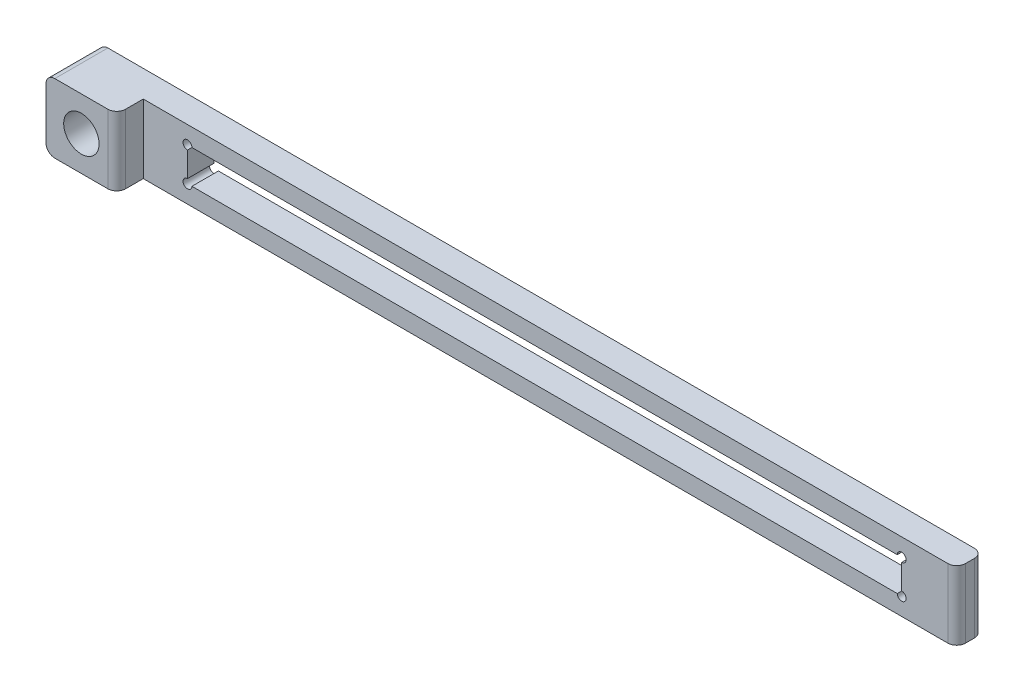
from build123d import *

# Parameters (mm, degrees)
SKIZZE1_W                            = 100
SKIZZE1_H                            = 7.8
SKIZZE1_W_2                          = 80.78
SKIZZE1_H_2                          = 3.8
AUFSATZ_LINEAR_AUSTRAGEN1_DEPTH      = 1.5
SKIZZE3_W                            = 8
SKIZZE3_H                            = 7.8
AUFSATZ_LINEAR_AUSTRAGEN2_DEPTH      = 3
SCHNITT_LINEAR_AUSTRAGEN4_DEPTH      = 51.509504056
SCHNITT_LINEAR_AUSTRAGEN4_DEPTH_BACK = 51.509504056
SKIZZE5_R                            = 2
VERRUNDUNG1_R                        = 1
VERRUNDUNG2_R                        = 1
VERRUNDUNG3_R                        = 1
VERRUNDUNG4_R                        = 1
VERRUNDUNG5_R                        = 1
LOCHUNGSSKIZZE_R                     = 0.5
RAHMENLOCHUNGEN_DEPTH                = 51.241516697


with BuildPart() as part:
    # Skizze1 → Aufsatz-Linear austragen1 (new, symmetric)
    with BuildSketch(Plane.XY):
        Rectangle(SKIZZE1_W, SKIZZE1_H)
        with Locations((3.39, 0)):
            Rectangle(SKIZZE1_W_2, SKIZZE1_H_2, mode=Mode.SUBTRACT)
    extrude(amount=AUFSATZ_LINEAR_AUSTRAGEN1_DEPTH, both=True)

    # Skizze3 → Aufsatz-Linear austragen2 (add)
    with BuildSketch(Plane.XY.offset(1.5)):
        with Locations((-46, 0)):
            Rectangle(SKIZZE3_W, SKIZZE3_H)
    extrude(amount=AUFSATZ_LINEAR_AUSTRAGEN2_DEPTH)

    # Skizze5 → Schnitt-Linear austragen4 (cut, two sides: drawn at the far end of the back side and taken through both)
    with BuildSketch(Plane.XY.offset(4.5).offset(-SCHNITT_LINEAR_AUSTRAGEN4_DEPTH_BACK)):
        with Locations((-46, 0)):
            Circle(SKIZZE5_R)
    extrude(amount=SCHNITT_LINEAR_AUSTRAGEN4_DEPTH + SCHNITT_LINEAR_AUSTRAGEN4_DEPTH_BACK, mode=Mode.SUBTRACT)

    # Verrundung1
    verrundung1_edges = [part.edges().sort_by_distance(p)[0] for p in [
        (-50, 3.9, 1.5),
    ]]
    fillet(verrundung1_edges, radius=VERRUNDUNG1_R)

    # Verrundung2
    verrundung2_edges = [part.edges().sort_by_distance(p)[0] for p in [
        (-50, -3.9, 1.5),
    ]]
    fillet(verrundung2_edges, radius=VERRUNDUNG2_R)

    # Verrundung3
    verrundung3_edges = [part.edges().sort_by_distance(p)[0] for p in [
        (-42, 0, 4.5),
    ]]
    fillet(verrundung3_edges, radius=VERRUNDUNG3_R)

    # Verrundung4
    verrundung4_edges = [part.edges().sort_by_distance(p)[0] for p in [
        (50, 0, -1.5),
    ]]
    fillet(verrundung4_edges, radius=VERRUNDUNG4_R)

    # Verrundung5
    verrundung5_edges = [part.edges().sort_by_distance(p)[0] for p in [
        (50, 0, 1.5),
    ]]
    fillet(verrundung5_edges, radius=VERRUNDUNG5_R)

    # Lochungsskizze → RahmenLochungen (cut, through all)
    with BuildSketch(Plane.XY.offset(1.5)):
        with Locations((-37, 1.9)):
            Circle(LOCHUNGSSKIZZE_R)
        with Locations((-37, -1.9)):
            Circle(LOCHUNGSSKIZZE_R)
        with Locations((43.78, -1.9)):
            Circle(LOCHUNGSSKIZZE_R)
        with Locations((43.78, 1.9)):
            Circle(LOCHUNGSSKIZZE_R)
    extrude(amount=-RAHMENLOCHUNGEN_DEPTH, mode=Mode.SUBTRACT)


solid = part.part
